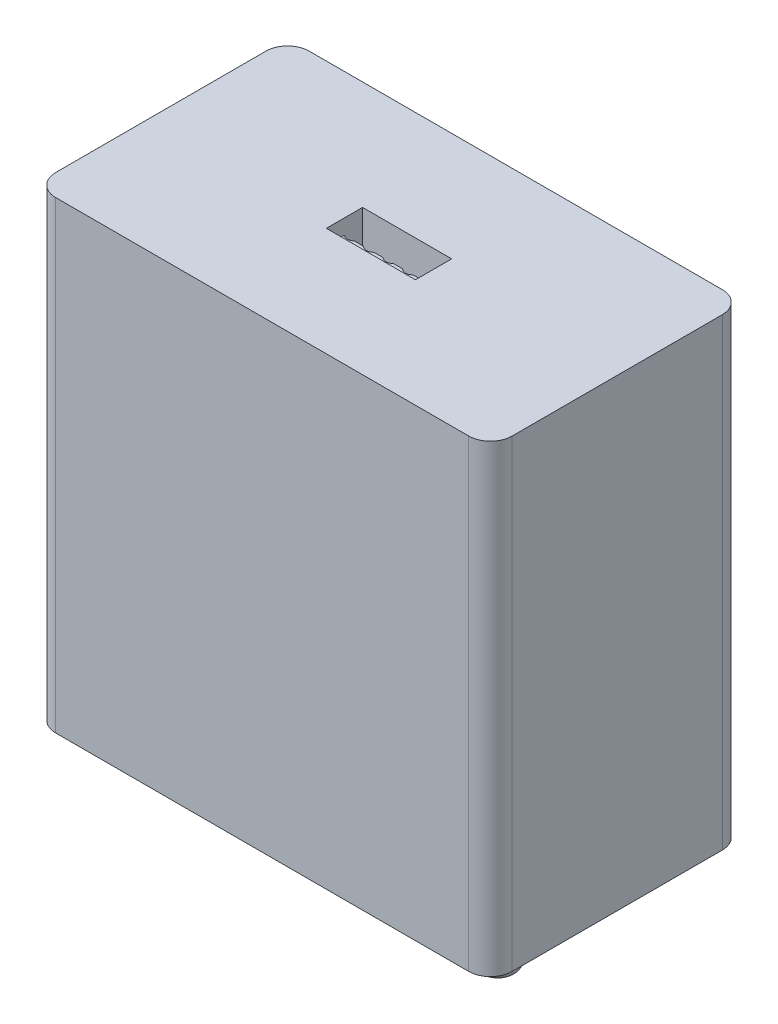
from build123d import *

# Parameters (mm, degrees)
SKETCH1_W           = 63
SKETCH1_H           = 35
BOSS_EXTRUDE1_DEPTH = 64
FILLET1_R           = 3
SKETCH2_R           = 2.5
BOSS_EXTRUDE2_DEPTH = 15
FILLET2_R           = 1
SKETCH4_R           = 0.5
CUT_EXTRUDE1_DEPTH  = 1
SKETCH5_W           = 12.3
SKETCH5_H           = 5
CUT_EXTRUDE2_DEPTH  = 13
BOSS_EXTRUDE3_DEPTH = 11


with BuildPart() as part:
    # Sketch1 → Boss-Extrude1 (new body)
    with BuildSketch(Plane(origin=(0, 0, 0), x_dir=(1, 0, 0), z_dir=(0, 1, 0))):
        Rectangle(SKETCH1_W, SKETCH1_H)
    extrude(amount=BOSS_EXTRUDE1_DEPTH)

    # Fillet1
    fillet1_edges = [part.edges().sort_by_distance(p)[0] for p in [
        (31.5, 32, 17.5),
        (-31.5, 32, 17.5),
        (-31.5, 32, -17.5),
        (31.5, 32, -17.5),
    ]]
    fillet(fillet1_edges, radius=FILLET1_R)

    # Sketch2 → Boss-Extrude2 (add)
    with BuildSketch(Plane.XZ):
        with Locations(Location((-15, 0, 0), (0, 0, 270))):
            Circle(SKETCH2_R)
        with Locations(Location((15, 0, 0), (0, 0, 90))):
            Circle(SKETCH2_R)
    extrude(amount=BOSS_EXTRUDE2_DEPTH)

    # Fillet2
    fillet2_edges = [part.edges().sort_by_distance(p)[0] for p in [
        (-15, -15, 2.5),
        (15, -15, -2.5),
    ]]
    fillet(fillet2_edges, radius=FILLET2_R)

    # Sketch4 → Cut-Extrude1 (cut)
    with BuildSketch(Plane.XZ):
        with Locations(Location((0, 0, 0), (0, 0, 270))):
            Circle(SKETCH4_R)
    extrude(amount=-CUT_EXTRUDE1_DEPTH, mode=Mode.SUBTRACT)

    # Sketch5 → Cut-Extrude2 (cut)
    with BuildSketch(Plane(origin=(0, 64, 0), x_dir=(1, 0, 0), z_dir=(0, 1, 0))):
        Rectangle(SKETCH5_W, SKETCH5_H)
    extrude(amount=-CUT_EXTRUDE2_DEPTH, mode=Mode.SUBTRACT)

    # Sketch6 → Boss-Extrude3 (add)
    with BuildSketch(Plane(origin=(0, 51, 0), x_dir=(1, 0, 0), z_dir=(0, 1, 0))):
        with BuildLine():
            Line((-6.07, -0.08), (-6.07, -2.42))
            Line((-6.07, -2.42), (6.07, -2.42))
            Line((6.07, -2.42), (6.07, -0.08))
            add(Edge.make_bspline(
                [(6.07, -0.08), (5.375982436, -0.656866539), (4.618995195, -0.08)],
                knots=[0.014708799, 0.014708799, 0.014708799, 0.930781283, 0.930781283, 0.930781283], degree=2))
            Line((4.618995195, -0.08), (3.421648134, -0.08))
            add(Edge.make_bspline(
                [(3.421648134, -0.08), (2.695459097, -0.701406982), (1.95, -0.08)],
                knots=[0.014708799, 0.014708799, 0.014708799, 0.984687043, 0.984687043, 0.984687043], degree=2))
            Line((1.95, -0.08), (0.721648134, -0.08))
            add(Edge.make_bspline(
                [(0.721648134, -0.08), (-0.004540903, -0.701406982), (-0.75, -0.08)],
                knots=[0.014708799, 0.014708799, 0.014708799, 0.984687043, 0.984687043, 0.984687043], degree=2))
            Line((-0.75, -0.08), (-1.978351866, -0.08))
            add(Edge.make_bspline(
                [(-1.978351866, -0.08), (-2.704540903, -0.701406982), (-3.45, -0.08)],
                knots=[0.014708799, 0.014708799, 0.014708799, 0.984687043, 0.984687043, 0.984687043], degree=2))
            Line((-3.45, -0.08), (-4.678351866, -0.08))
            add(Edge.make_bspline(
                [(-4.678351866, -0.08), (-5.393535509, -0.624780928), (-6.07, -0.08)],
                knots=[0.084890823, 0.084890823, 0.084890823, 0.984687043, 0.984687043, 0.984687043], degree=2))
        make_face()
    extrude(amount=BOSS_EXTRUDE3_DEPTH)


solid = part.part
